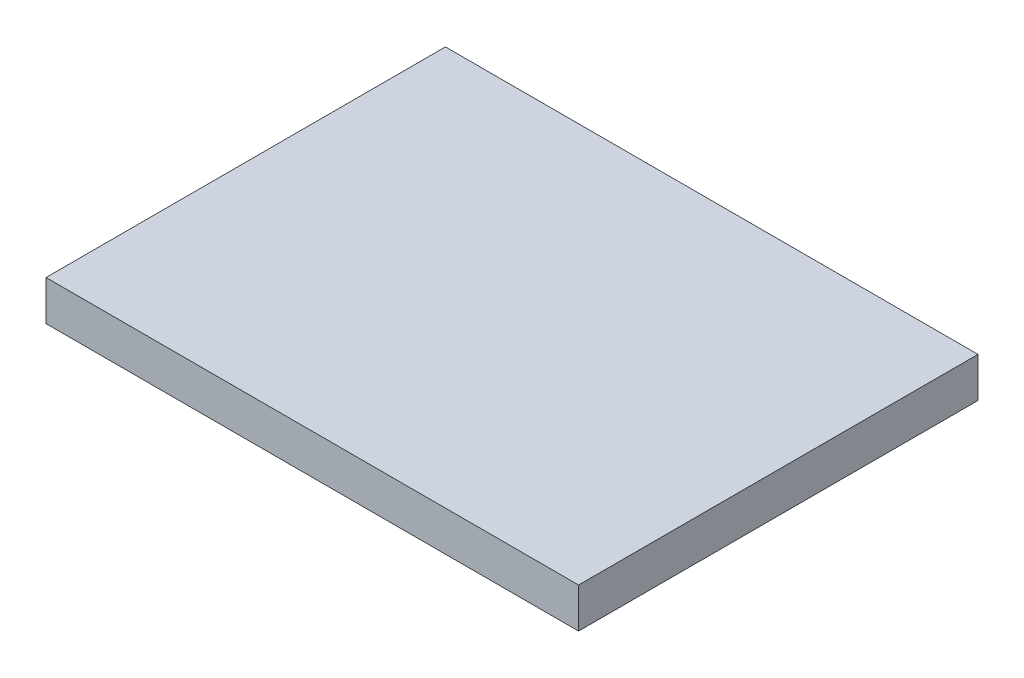
from build123d import *

# Parameters (mm, degrees)
SKETCH1_W           = 400
SKETCH1_H           = 30
BOSS_EXTRUDE1_DEPTH = 150


with BuildPart() as part:
    # Sketch1 → Boss-Extrude1 (new, symmetric)
    with BuildSketch(Plane.XY):
        with Locations((71.211975439, 518.994449049)):
            Rectangle(SKETCH1_W, SKETCH1_H)
    extrude(amount=BOSS_EXTRUDE1_DEPTH, both=True)


solid = part.part
